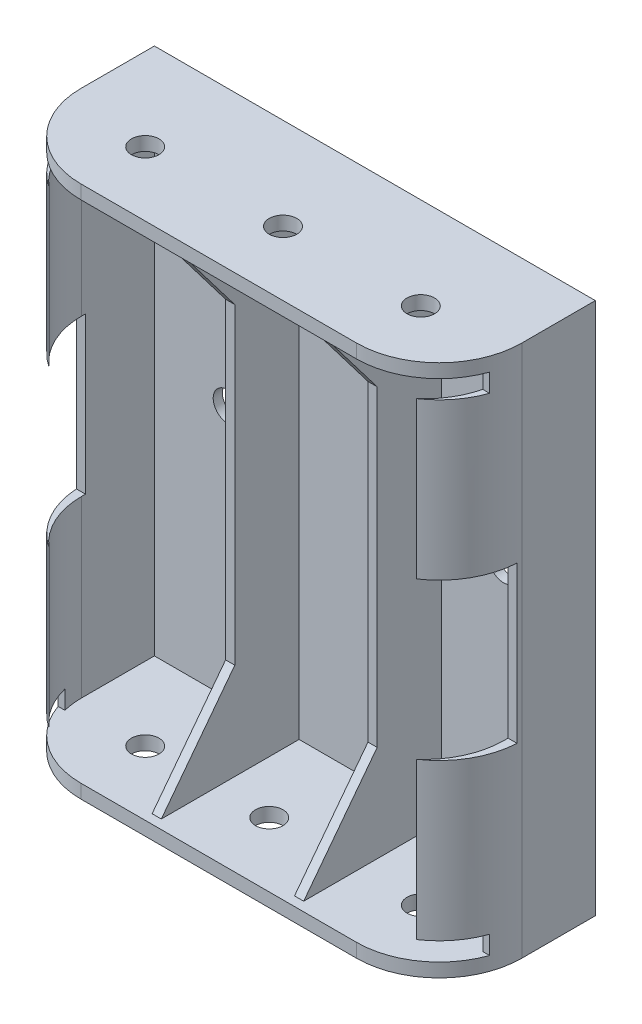
from build123d import *

# Parameters (mm, degrees)
BOSS_EXTRUDE1_DEPTH     = 29
CUT_EXTRUDE1_START      = -1.5
CUT_EXTRUDE1_DEPTH      = 55
BOSS_EXTRUDE2_DEPTH     = 0.5
CUT_EXTRUDE2_DEPTH      = 42.303752856
CUT_EXTRUDE2_DEPTH_BACK = 42.303752856
SKETCH5_W               = 8.5
SKETCH5_H               = 17
SKETCH6_W               = 6
SKETCH6_H               = 2
CUT_EXTRUDE3_DEPTH      = 10
SKETCH7_R               = 1.5
CUT_EXTRUDE4_DEPTH      = 10
CUT_EXTRUDE5_START      = -10
SKETCH8_R               = 1.5
CUT_EXTRUDE5_DEPTH      = 10
SKETCH9_R               = 1.6
CUT_EXTRUDE6_DEPTH      = 42.303752856


with BuildPart() as part:
    # Sketch2 → Boss-Extrude1 (new, symmetric)
    with BuildSketch(Plane(origin=(0, 0, 0), x_dir=(1, 0, 0), z_dir=(0, 1, 0))):
        with BuildLine():
            Line((24, 0), (-24, 0))
            Line((-24, 0), (-24, -8))
            ThreePointArc((-24, -8), (-21.363961031, -14.363961031), (-15, -17))
            Line((-15, -17), (15, -17))
            ThreePointArc((15, -17), (21.363961031, -14.363961031), (24, -8))
            Line((24, -8), (24, 0))
        make_face()
    extrude(amount=BOSS_EXTRUDE1_DEPTH, both=True)

    # Sketch3 → Cut-Extrude1 (cut)
    with BuildSketch(Plane.XZ.offset(29).offset(CUT_EXTRUDE1_START)):
        with BuildLine():
            Line((-14.319593213, 17.6), (14.319593213, 17.6))
            ThreePointArc((14.319593213, 17.6), (20.457567716, 15.057567716), (23, 8.919593213))
            Line((23, 8.919593213), (23, 1))
            Line((23, 1), (-23, 1))
            Line((-23, 1), (-23, 8.919593213))
            ThreePointArc((-23, 8.919593213), (-20.457567716, 15.057567716), (-14.319593213, 17.6))
        make_face()
    extrude(amount=-CUT_EXTRUDE1_DEPTH, mode=Mode.SUBTRACT)

    # Sketch4 → Boss-Extrude2 (add, symmetric)
    with BuildSketch(Plane(origin=(7.75, 0, 0), x_dir=(0, 0, -1), z_dir=(1, 0, 0))):
        Polygon((-16, 27.5), (-1, 27.5), (-1, -27.5), (-16, -27.5), (-8, -17), (-8, 17), align=None)
    boss_extrude2 = extrude(amount=BOSS_EXTRUDE2_DEPTH, both=True)

    # Mirror1: Boss-Extrude2 across plane
    add(boss_extrude2.mirror(Plane(origin=(0, 0, 0), x_dir=(0, 0, 1), z_dir=(1, 0, 0))))

    # Sketch5 → Cut-Extrude2 (cut, two sides: drawn at the far end of the back side and taken through both)
    with BuildSketch(Plane(origin=(0, 0, 0), x_dir=(0, 0, -1), z_dir=(1, 0, 0)).offset(-CUT_EXTRUDE2_DEPTH_BACK)):
        with Locations((-12.75, 0)):
            Rectangle(SKETCH5_W, SKETCH5_H)
    extrude(amount=CUT_EXTRUDE2_DEPTH + CUT_EXTRUDE2_DEPTH_BACK, mode=Mode.SUBTRACT)

    # Sketch6 → Cut-Extrude3 (cut)
    with BuildSketch(Plane(origin=(24, 0, 0), x_dir=(0, 0, -1), z_dir=(1, 0, 0))):
        with Locations((-14, 26.5)):
            Rectangle(SKETCH6_W, SKETCH6_H)
        with Locations((-14, -26.5)):
            Rectangle(SKETCH6_W, SKETCH6_H)
    cut_extrude3 = extrude(amount=-CUT_EXTRUDE3_DEPTH, mode=Mode.SUBTRACT)

    # Mirror2: Cut-Extrude3 across plane
    add(cut_extrude3.mirror(Plane(origin=(0, 0, 0), x_dir=(0, 0, 1), z_dir=(1, 0, 0))), mode=Mode.SUBTRACT)

    # Sketch7 → Cut-Extrude4 (cut)
    with BuildSketch(Plane(origin=(0, 29, 0), x_dir=(1, 0, 0), z_dir=(0, 1, 0))):
        with Locations(Location((-15, -10, 0), (0, 0, 270))):
            Circle(SKETCH7_R)
        with Locations(Location((0, -10, 0), (0, 0, 270))):
            Circle(SKETCH7_R)
        with Locations(Location((15, -10, 0), (0, 0, 270))):
            Circle(SKETCH7_R)
    extrude(amount=-CUT_EXTRUDE4_DEPTH, mode=Mode.SUBTRACT)

    # Sketch8 → Cut-Extrude5 (cut)
    with BuildSketch(Plane.XZ.offset(29).offset(CUT_EXTRUDE5_START)):
        with Locations(Location((-15, 10, 0), (0, 0, 90))):
            Circle(SKETCH8_R)
        with Locations(Location((15, 10, 0), (0, 0, 90))):
            Circle(SKETCH8_R)
        with Locations(Location((-1.5, 10, 0), (0, 0, 270))):
            Circle(SKETCH8_R)
    extrude(amount=CUT_EXTRUDE5_DEPTH, mode=Mode.SUBTRACT)

    # Sketch9 → Cut-Extrude6 (cut, through all)
    with BuildSketch(Plane(origin=(0, 0, 0), x_dir=(-1, 0, 0), z_dir=(0, 0, -1))):
        with Locations((-15, 0)):
            Circle(SKETCH9_R)
        with Locations((15, 0)):
            Circle(SKETCH9_R)
    extrude(amount=-CUT_EXTRUDE6_DEPTH, mode=Mode.SUBTRACT)


solid = part.part
